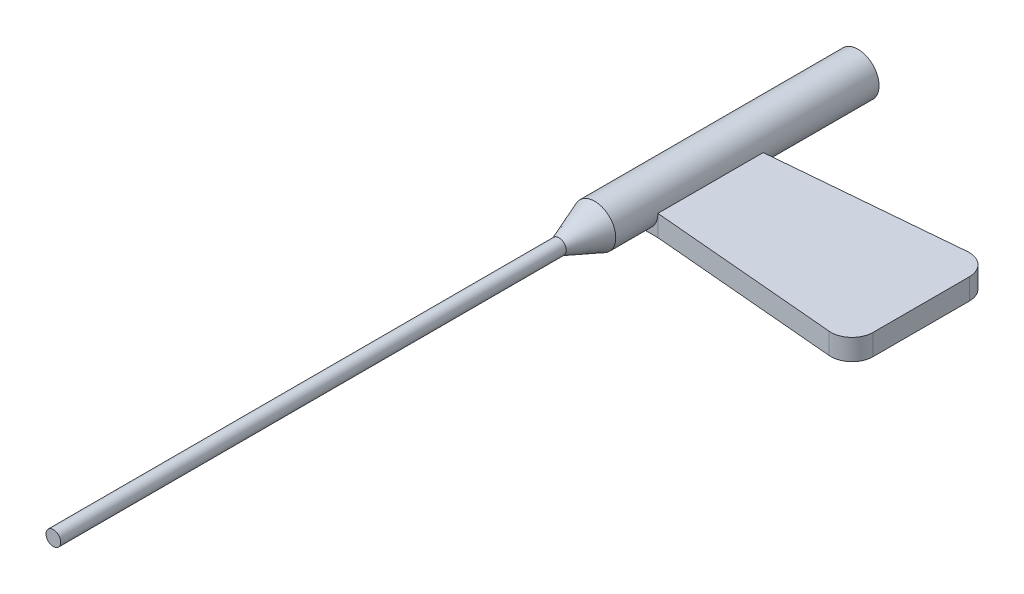
from build123d import *

# Parameters (mm, degrees)
SKETCH_1_R      = 1
EXTRUDE_1_DEPTH = 12.5
EXTRUDE_2_DEPTH = 1
EXTRUDE_3_REACH = 18.039
SKETCH_3_W      = 5
SKETCH_3_H      = 1
FILLET_1_R      = 1


with BuildPart() as part:
    # 草图1 → 凸台-拉伸1 (new body)
    with BuildSketch(Plane.XY):
        Circle(SKETCH_1_R)
    extrude(amount=EXTRUDE_1_DEPTH)

    # 草图3 → 凸台-拉伸3 (add, up to next)
    with BuildSketch(Plane.ZY.offset(-1), mode=Mode.PRIVATE) as extrude_3_sk1:
        with Locations((8, -0.5)):
            Rectangle(SKETCH_3_W, SKETCH_3_H)
    extrude_3_tool1 = extrude(extrude_3_sk1.sketch, amount=EXTRUDE_3_REACH, mode=Mode.PRIVATE) - part.part


with BuildPart() as body_2:
    # 草图2 → 凸台-拉伸2 (new body)
    with BuildSketch(Plane(origin=(0, 0, 0), x_dir=(1, 0, 0), z_dir=(0, 1, 0))):
        Polygon((1, -10.5), (1, -5.5), (11, -4.625113365), (11, -11.374886635), align=None)
    extrude(amount=-EXTRUDE_2_DEPTH)


with BuildPart() as part_1:
    add(part.part)

    add(body_2.part)  # 凸台-拉伸3 merges body 2
    add(extrude_3_tool1.solids().sort_by_distance((1, -0.5, 8))[0])

    # 草图5 → 旋转2 (revolve)
    with BuildSketch(Plane(origin=(0, 0, 0), x_dir=(1, 0, 0), z_dir=(0, 1, 0)), mode=Mode.PRIVATE) as revolve_2_sk:
        Polygon((-1, -12.5), (-0.35, -14.2), (-0.35, -38.2), (0, -38.2), (0, -14.2), (0, -12.5), align=None)
    revolve(revolve_2_sk.sketch.rotate(Axis((0, 0, 38.2), (0, 0, -1)), 180), axis=Axis((0, 0, 38.2), (0, 0, -1)))

    # 圆角1
    fillet_1_edges = [part_1.edges().sort_by_distance(p)[0] for p in [
        (11, -0.5, 11.374886635),
        (11, -0.5, 4.625113365),
    ]]
    fillet(fillet_1_edges, radius=FILLET_1_R)


solid = part_1.part
